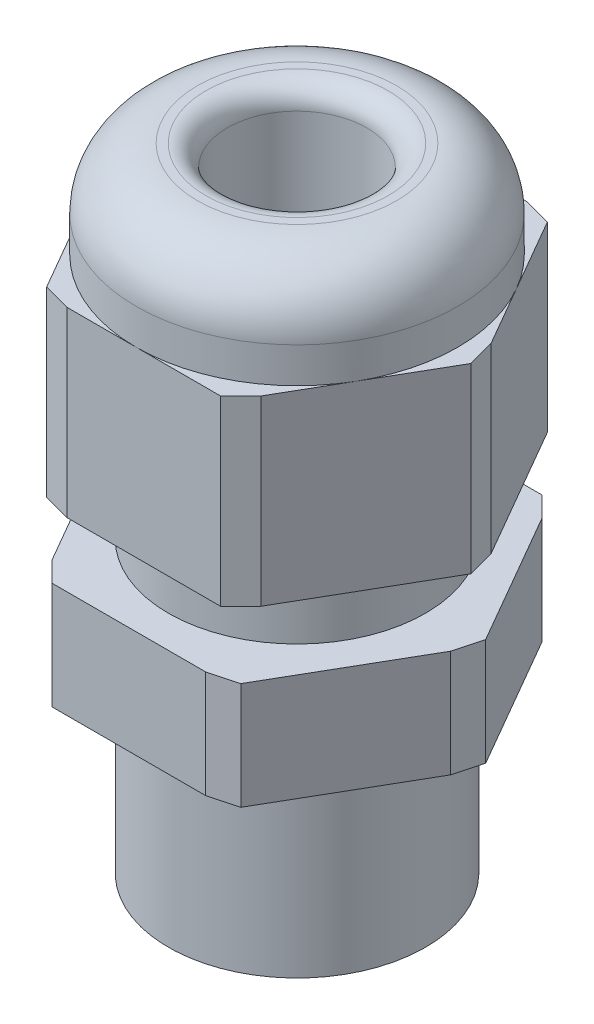
from build123d import *
from OCP.BRepFilletAPI import BRepFilletAPI_MakeChamfer

# Parameters (mm, degrees)
BOSS_EXTRUDE1_DEPTH = 8.5
SKETCH4_R           = 6
BOSS_EXTRUDE2_DEPTH = 3
BOSS_EXTRUDE3_DEPTH = 5
SKETCH6_R           = 6
BOSS_EXTRUDE4_DEPTH = 8.5
SKETCH3_R           = 3.25
CUT_EXTRUDE1_DEPTH  = 32.646484797
FILLET1_R           = 1
CHAMFER1_SIZE       = 0.4
CHAMFER1_SIZE2      = 1.092820323


with BuildPart() as part:
    # Sketch1 → Boss-Extrude1 (new body)
    with BuildSketch(Plane(origin=(0, 0, 0), x_dir=(1, 0, 0), z_dir=(0, 1, 0))):
        Polygon((8.660254038, 0), (4.330127019, 7.5), (-4.330127019, 7.5), (-8.660254038, 0), (-4.330127019, -7.5), (4.330127019, -7.5), align=None)
    extrude(amount=BOSS_EXTRUDE1_DEPTH)

    # Sketch2 → Revolve1 (revolve)
    with BuildSketch(Plane(origin=(0, 0, 0), x_dir=(0, 0, -1), z_dir=(1, 0, 0))):
        with BuildLine():
            Line((-7.5, 8.5), (-7.5, 10.15))
            ThreePointArc((-7.5, 10.15), (-6.665254326, 12.165254326), (-4.65, 13))
            Line((-4.65, 13), (0, 13))
            Line((0, 13), (0, 8.5))
            Line((0, 8.5), (-7.5, 8.5))
        make_face()
    revolve(axis=Axis((0, 13, 0), (0, -1, 0)))

    # Sketch4 → Boss-Extrude2 (add)
    with BuildSketch(Plane(origin=(0, 0, 0), x_dir=(1, 0, 0), z_dir=(0, 1, 0))):
        with Locations(Location((0, 0, 0), (0, 0, 270))):
            Circle(SKETCH4_R)
    extrude(amount=-BOSS_EXTRUDE2_DEPTH)

    # Sketch5 → Boss-Extrude3 (add)
    with BuildSketch(Plane.XZ.offset(3)):
        Polygon((8.660254038, 0), (4.330127019, 7.5), (-4.330127019, 7.5), (-8.660254038, 0), (-4.330127019, -7.5), (4.330127019, -7.5), align=None)
    extrude(amount=BOSS_EXTRUDE3_DEPTH)

    # Sketch6 → Boss-Extrude4 (add)
    with BuildSketch(Plane.XZ.offset(8)):
        with Locations(Location((0, 0, 0), (0, 0, 90))):
            Circle(SKETCH6_R)
    extrude(amount=BOSS_EXTRUDE4_DEPTH)

    # Sketch3 → Cut-Extrude1 (cut, through all)
    with BuildSketch(Plane(origin=(0, 13, 0), x_dir=(1, 0, 0), z_dir=(0, 1, 0))):
        with Locations(Location((0, 0, 0), (0, 0, 270))):
            Circle(SKETCH3_R)
    extrude(amount=-CUT_EXTRUDE1_DEPTH, mode=Mode.SUBTRACT)

    # Fillet1
    fillet1_edges = [part.edges().sort_by_distance(p)[0] for p in [
        (0, 13, -3.25),
    ]]
    fillet(fillet1_edges, radius=FILLET1_R)

    # Chamfer1: one chamfer whose edges measure the first distance from different faces: ONE call of the kernel's chamfer builder (chamfer() names one face for all edges)
    chamfer1_edges_1 = [part.edges().sort_by_distance(p)[0] for p in [
        (4.330127019, 4.25, 7.5),
    ]]
    chamfer1_side_1 = [part.faces().sort_by_distance(p)[0] for p in [
        (0, 4.25, 7.5),
    ]]
    chamfer1_edges_2 = [part.edges().sort_by_distance(p)[0] for p in [
        (-4.330127019, 4.25, 7.5),
    ]]
    chamfer1_side_2 = [part.faces().sort_by_distance(p)[0] for p in [
        (-6.495190528, 4.25, 3.75),
    ]]
    chamfer1_edges_3 = [part.edges().sort_by_distance(p)[0] for p in [
        (-8.660254038, 4.25, 0),
    ]]
    chamfer1_side_3 = [part.faces().sort_by_distance(p)[0] for p in [
        (-6.495190528, 4.25, -3.75),
    ]]
    chamfer1_edges_4 = [part.edges().sort_by_distance(p)[0] for p in [
        (-4.330127019, 4.25, -7.5),
    ]]
    chamfer1_side_4 = [part.faces().sort_by_distance(p)[0] for p in [
        (0, 4.25, -7.5),
    ]]
    chamfer1_edges_5 = [part.edges().sort_by_distance(p)[0] for p in [
        (4.330127019, 4.25, -7.5),
    ]]
    chamfer1_side_5 = [part.faces().sort_by_distance(p)[0] for p in [
        (6.495190528, 4.25, -3.75),
    ]]
    chamfer1_edges_6 = [part.edges().sort_by_distance(p)[0] for p in [
        (8.660254038, 4.25, 0),
    ]]
    chamfer1_side_6 = [part.faces().sort_by_distance(p)[0] for p in [
        (6.495190528, 4.25, 3.75),
    ]]
    chamfer1_edges_7 = [part.edges().sort_by_distance(p)[0] for p in [
        (4.330127019, -5.5, -7.5),
    ]]
    chamfer1_side_7 = [part.faces().sort_by_distance(p)[0] for p in [
        (0, -5.5, -7.5),
    ]]
    chamfer1_edges_8 = [part.edges().sort_by_distance(p)[0] for p in [
        (8.660254038, -5.5, 0),
    ]]
    chamfer1_side_8 = [part.faces().sort_by_distance(p)[0] for p in [
        (6.495190528, -5.5, -3.75),
    ]]
    chamfer1_edges_9 = [part.edges().sort_by_distance(p)[0] for p in [
        (4.330127019, -5.5, 7.5),
    ]]
    chamfer1_side_9 = [part.faces().sort_by_distance(p)[0] for p in [
        (6.495190528, -5.5, 3.75),
    ]]
    chamfer1_edges_10 = [part.edges().sort_by_distance(p)[0] for p in [
        (-4.330127019, -5.5, 7.5),
    ]]
    chamfer1_side_10 = [part.faces().sort_by_distance(p)[0] for p in [
        (0, -5.5, 7.5),
    ]]
    chamfer1_edges_11 = [part.edges().sort_by_distance(p)[0] for p in [
        (-8.660254038, -5.5, 0),
    ]]
    chamfer1_side_11 = [part.faces().sort_by_distance(p)[0] for p in [
        (-6.495190528, -5.5, 3.75),
    ]]
    chamfer1_edges_12 = [part.edges().sort_by_distance(p)[0] for p in [
        (-4.330127019, -5.5, -7.5),
    ]]
    chamfer1_side_12 = [part.faces().sort_by_distance(p)[0] for p in [
        (-6.495190528, -5.5, -3.75),
    ]]
    chamfer1 = BRepFilletAPI_MakeChamfer(part.part.solid().wrapped)
    for e in chamfer1_edges_1:
        chamfer1.Add(CHAMFER1_SIZE, CHAMFER1_SIZE2, e.wrapped, chamfer1_side_1[0].wrapped)  # the first distance lies on this face
    for e in chamfer1_edges_2:
        chamfer1.Add(CHAMFER1_SIZE, CHAMFER1_SIZE2, e.wrapped, chamfer1_side_2[0].wrapped)  # the first distance lies on this face
    for e in chamfer1_edges_3:
        chamfer1.Add(CHAMFER1_SIZE, CHAMFER1_SIZE2, e.wrapped, chamfer1_side_3[0].wrapped)  # the first distance lies on this face
    for e in chamfer1_edges_4:
        chamfer1.Add(CHAMFER1_SIZE, CHAMFER1_SIZE2, e.wrapped, chamfer1_side_4[0].wrapped)  # the first distance lies on this face
    for e in chamfer1_edges_5:
        chamfer1.Add(CHAMFER1_SIZE, CHAMFER1_SIZE2, e.wrapped, chamfer1_side_5[0].wrapped)  # the first distance lies on this face
    for e in chamfer1_edges_6:
        chamfer1.Add(CHAMFER1_SIZE, CHAMFER1_SIZE2, e.wrapped, chamfer1_side_6[0].wrapped)  # the first distance lies on this face
    for e in chamfer1_edges_7:
        chamfer1.Add(CHAMFER1_SIZE, CHAMFER1_SIZE2, e.wrapped, chamfer1_side_7[0].wrapped)  # the first distance lies on this face
    for e in chamfer1_edges_8:
        chamfer1.Add(CHAMFER1_SIZE, CHAMFER1_SIZE2, e.wrapped, chamfer1_side_8[0].wrapped)  # the first distance lies on this face
    for e in chamfer1_edges_9:
        chamfer1.Add(CHAMFER1_SIZE, CHAMFER1_SIZE2, e.wrapped, chamfer1_side_9[0].wrapped)  # the first distance lies on this face
    for e in chamfer1_edges_10:
        chamfer1.Add(CHAMFER1_SIZE, CHAMFER1_SIZE2, e.wrapped, chamfer1_side_10[0].wrapped)  # the first distance lies on this face
    for e in chamfer1_edges_11:
        chamfer1.Add(CHAMFER1_SIZE, CHAMFER1_SIZE2, e.wrapped, chamfer1_side_11[0].wrapped)  # the first distance lies on this face
    for e in chamfer1_edges_12:
        chamfer1.Add(CHAMFER1_SIZE, CHAMFER1_SIZE2, e.wrapped, chamfer1_side_12[0].wrapped)  # the first distance lies on this face
    add(Compound.cast(chamfer1.Shape()), mode=Mode.REPLACE)


solid = part.part
